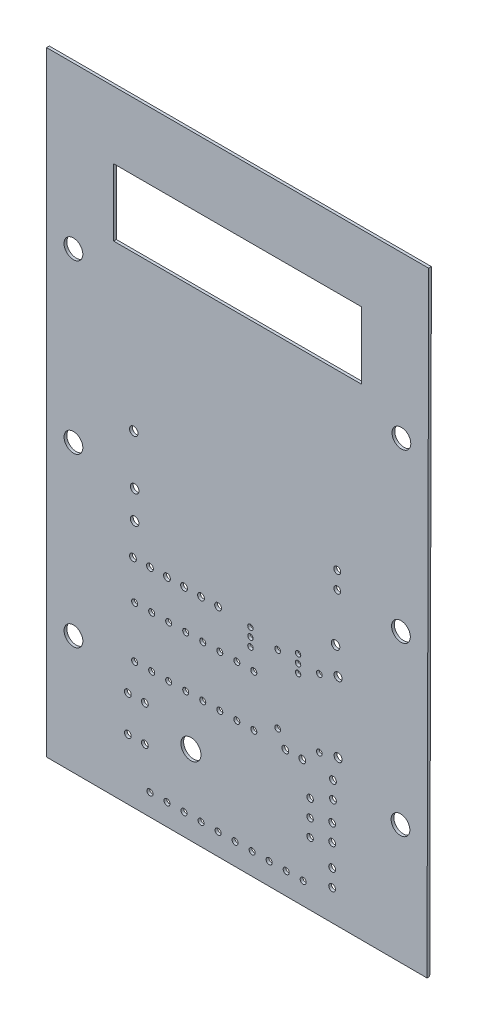
from build123d import *

# Parameters (mm, degrees)
SKETCH1_R           = 0.508
SKETCH1_R_2         = 0.5999988
SKETCH1_R_3         = 0.635
SKETCH1_R_4         = 0.3999992
SKETCH1_R_5         = 0.42500042
SKETCH1_R_6         = 0.4499991
SKETCH1_R_7         = 0.4826
SKETCH1_R_8         = 1.499997
SKETCH1_R_9         = 1.4
SKETCH1_W           = 36.995943026
SKETCH1_H           = 10
BOSS_EXTRUDE1_DEPTH = 0.41148


with BuildPart() as part:
    # Sketch1 → Boss-Extrude1 (new body)
    with BuildSketch(Plane.XY):
        Polygon((70.438392982, 67.709058894), (127.180315397, 67.544049582), (127.428203039, 159.380807101), (70.428082966, 159.380807101), align=None)
        with Locations(Location((113.792, 110.998, 0), (0, 0, 180))):
            Circle(SKETCH1_R, mode=Mode.SUBTRACT)
        with Locations(Location((113.792, 113.538, 0), (0, 0, 180))):
            Circle(SKETCH1_R, mode=Mode.SUBTRACT)
        with Locations(Location((113.919, 99.8449997, 0), (0, 0, 180))):
            Circle(SKETCH1_R_2, mode=Mode.SUBTRACT)
        with Locations(Location((113.538, 103.759, 0), (0, 0, 180))):
            Circle(SKETCH1_R_3, mode=Mode.SUBTRACT)
        with Locations(Location((107.95, 99.822, 0), (0, 0, 180))):
            Circle(SKETCH1_R_4, mode=Mode.SUBTRACT)
        with Locations(Location((111.125, 98.806, 0), (0, 0, 180))):
            Circle(SKETCH1_R_5, mode=Mode.SUBTRACT)
        with Locations(Location((113.919, 89.3850003, 0), (0, 0, 180))):
            Circle(SKETCH1_R_2, mode=Mode.SUBTRACT)
        with Locations(Location((107.95, 98.552, 0), (0, 0, 180))):
            Circle(SKETCH1_R_4, mode=Mode.SUBTRACT)
        with Locations(Location((111.125, 88.646, 0), (0, 0, 180))):
            Circle(SKETCH1_R_5, mode=Mode.SUBTRACT)
        with Locations(Location((104.902, 98.806, 0), (0, 0, 180))):
            Circle(SKETCH1_R_5, mode=Mode.SUBTRACT)
        with Locations(Location((107.95, 97.282, 0), (0, 0, 180))):
            Circle(SKETCH1_R_4, mode=Mode.SUBTRACT)
        with Locations(Location((100.838, 99.695, 0), (0, 0, 180))):
            Circle(SKETCH1_R_4, mode=Mode.SUBTRACT)
        with Locations(Location((100.838, 98.425, 0), (0, 0, 180))):
            Circle(SKETCH1_R_4, mode=Mode.SUBTRACT)
        with Locations(Location((101.346, 94.234, 0), (0, 0, 180))):
            Circle(SKETCH1_R_6, mode=Mode.SUBTRACT)
        with Locations(Location((104.902, 88.646, 0), (0, 0, 180))):
            Circle(SKETCH1_R_5, mode=Mode.SUBTRACT)
        with Locations(Location((100.838, 97.155, 0), (0, 0, 180))):
            Circle(SKETCH1_R_4, mode=Mode.SUBTRACT)
        with Locations(Location((101.346, 86.614, 0), (0, 0, 180))):
            Circle(SKETCH1_R_6, mode=Mode.SUBTRACT)
        with Locations(Location((113.157, 86.106, 0), (0, 0, 180))):
            Circle(SKETCH1_R, mode=Mode.SUBTRACT)
        with Locations(Location((113.157, 83.566, 0), (0, 0, 180))):
            Circle(SKETCH1_R, mode=Mode.SUBTRACT)
        with Locations(Location((109.74201826, 82.0511948, 0), (0, 0, 180))):
            Circle(SKETCH1_R_7, mode=Mode.SUBTRACT)
        with Locations(Location((113.03, 80.518, 0), (0, 0, 180))):
            Circle(SKETCH1_R, mode=Mode.SUBTRACT)
        with Locations(Location((113.03, 74.676, 0), (0, 0, 180))):
            Circle(SKETCH1_R, mode=Mode.SUBTRACT)
        with Locations(Location((113.03, 72.136, 0), (0, 0, 180))):
            Circle(SKETCH1_R, mode=Mode.SUBTRACT)
        with Locations(Location((109.74201826, 79.5111948, 0), (0, 0, 180))):
            Circle(SKETCH1_R_7, mode=Mode.SUBTRACT)
        with Locations(Location((113.03, 77.978, 0), (0, 0, 180))):
            Circle(SKETCH1_R, mode=Mode.SUBTRACT)
        with Locations(Location((108.585, 86.487, 0), (0, 0, 180))):
            Circle(SKETCH1_R, mode=Mode.SUBTRACT)
        with Locations(Location((109.74201826, 76.9711948, 0), (0, 0, 180))):
            Circle(SKETCH1_R_7, mode=Mode.SUBTRACT)
        with Locations(Location((98.806, 86.614, 0), (0, 0, 180))):
            Circle(SKETCH1_R_6, mode=Mode.SUBTRACT)
        with Locations(Location((106.045, 86.487, 0), (0, 0, 180))):
            Circle(SKETCH1_R, mode=Mode.SUBTRACT)
        with Locations(Location((106.172, 70.866, 0), (0, 0, 180))):
            Circle(SKETCH1_R_6, mode=Mode.SUBTRACT)
        with Locations(Location((108.712, 70.866, 0), (0, 0, 180))):
            Circle(SKETCH1_R_6, mode=Mode.SUBTRACT)
        with Locations(Location((101.092, 70.866, 0), (0, 0, 180))):
            Circle(SKETCH1_R_6, mode=Mode.SUBTRACT)
        with Locations(Location((103.632, 70.866, 0), (0, 0, 180))):
            Circle(SKETCH1_R_6, mode=Mode.SUBTRACT)
        with Locations(Location((96.266, 94.234, 0), (0, 0, 180))):
            Circle(SKETCH1_R_6, mode=Mode.SUBTRACT)
        with Locations(Location((96.012, 99.949, 0), (0, 0, 180))):
            Circle(SKETCH1_R, mode=Mode.SUBTRACT)
        with Locations(Location((93.726, 94.234, 0), (0, 0, 180))):
            Circle(SKETCH1_R_6, mode=Mode.SUBTRACT)
        with Locations(Location((90.932, 99.949, 0), (0, 0, 180))):
            Circle(SKETCH1_R, mode=Mode.SUBTRACT)
        with Locations(Location((93.472, 99.949, 0), (0, 0, 180))):
            Circle(SKETCH1_R, mode=Mode.SUBTRACT)
        with Locations(Location((98.806, 94.234, 0), (0, 0, 180))):
            Circle(SKETCH1_R_6, mode=Mode.SUBTRACT)
        with Locations(Location((93.726, 86.614, 0), (0, 0, 180))):
            Circle(SKETCH1_R_6, mode=Mode.SUBTRACT)
        with Locations(Location((88.646, 94.234, 0), (0, 0, 180))):
            Circle(SKETCH1_R_6, mode=Mode.SUBTRACT)
        with Locations(Location((91.186, 94.234, 0), (0, 0, 180))):
            Circle(SKETCH1_R_6, mode=Mode.SUBTRACT)
        with Locations(Location((83.566, 104.775, 0), (0, 0, 180))):
            Circle(SKETCH1_R_3, mode=Mode.SUBTRACT)
        with Locations(Location((85.852, 99.949, 0), (0, 0, 180))):
            Circle(SKETCH1_R, mode=Mode.SUBTRACT)
        with Locations(Location((83.439, 116.332, 0), (0, 0, 180))):
            Circle(SKETCH1_R_3, mode=Mode.SUBTRACT)
        with Locations(Location((83.566, 108.966, 0), (0, 0, 180))):
            Circle(SKETCH1_R_3, mode=Mode.SUBTRACT)
        with Locations(Location((88.392, 99.949, 0), (0, 0, 180))):
            Circle(SKETCH1_R, mode=Mode.SUBTRACT)
        with Locations(Location((86.106, 94.234, 0), (0, 0, 180))):
            Circle(SKETCH1_R_6, mode=Mode.SUBTRACT)
        with Locations(Location((83.312, 99.949, 0), (0, 0, 180))):
            Circle(SKETCH1_R, mode=Mode.SUBTRACT)
        with Locations(Location((83.566, 94.234, 0), (0, 0, 180))):
            Circle(SKETCH1_R_6, mode=Mode.SUBTRACT)
        with Locations(Location((91.186, 86.614, 0), (0, 0, 180))):
            Circle(SKETCH1_R_6, mode=Mode.SUBTRACT)
        with Locations(Location((96.266, 86.614, 0), (0, 0, 180))):
            Circle(SKETCH1_R_6, mode=Mode.SUBTRACT)
        with Locations(Location((88.646, 86.614, 0), (0, 0, 180))):
            Circle(SKETCH1_R_6, mode=Mode.SUBTRACT)
        with Locations(Location((91.9620208, 79.5111948, 0), (0, 0, 180))):
            Circle(SKETCH1_R_8, mode=Mode.SUBTRACT)
        with Locations(Location((96.012, 70.866, 0), (0, 0, 180))):
            Circle(SKETCH1_R_6, mode=Mode.SUBTRACT)
        with Locations(Location((98.552, 70.866, 0), (0, 0, 180))):
            Circle(SKETCH1_R_6, mode=Mode.SUBTRACT)
        with Locations(Location((90.932, 70.866, 0), (0, 0, 180))):
            Circle(SKETCH1_R_6, mode=Mode.SUBTRACT)
        with Locations(Location((93.472, 70.866, 0), (0, 0, 180))):
            Circle(SKETCH1_R_6, mode=Mode.SUBTRACT)
        with Locations(Location((86.106, 86.614, 0), (0, 0, 180))):
            Circle(SKETCH1_R_6, mode=Mode.SUBTRACT)
        with Locations(Location((85.09, 82.042, 0), (0, 0, 180))):
            Circle(SKETCH1_R, mode=Mode.SUBTRACT)
        with Locations(Location((83.566, 86.614, 0), (0, 0, 180))):
            Circle(SKETCH1_R_6, mode=Mode.SUBTRACT)
        with Locations(Location((82.55, 82.042, 0), (0, 0, 180))):
            Circle(SKETCH1_R, mode=Mode.SUBTRACT)
        with Locations(Location((85.852, 70.866, 0), (0, 0, 180))):
            Circle(SKETCH1_R_6, mode=Mode.SUBTRACT)
        with Locations(Location((88.392, 70.866, 0), (0, 0, 180))):
            Circle(SKETCH1_R_6, mode=Mode.SUBTRACT)
        with Locations(Location((82.55, 76.708, 0), (0, 0, 180))):
            Circle(SKETCH1_R, mode=Mode.SUBTRACT)
        with Locations(Location((85.09, 76.708, 0), (0, 0, 180))):
            Circle(SKETCH1_R, mode=Mode.SUBTRACT)
        with Locations((123.36340718, 135.380807101)):
            Circle(SKETCH1_R_9, mode=Mode.SUBTRACT)
        with Locations((74.430782191, 135.380807101)):
            Circle(SKETCH1_R_9, mode=Mode.SUBTRACT)
        with Locations((74.433593858, 110.380807101)):
            Circle(SKETCH1_R_9, mode=Mode.SUBTRACT)
        with Locations((123.295926672, 110.380807101)):
            Circle(SKETCH1_R_9, mode=Mode.SUBTRACT)
        with Locations((74.436405524, 85.380807101)):
            Circle(SKETCH1_R_9, mode=Mode.SUBTRACT)
        with Locations((123.228446164, 85.380807101)):
            Circle(SKETCH1_R_9, mode=Mode.SUBTRACT)
        with Locations((98.932971513, 144.380807101)):
            Rectangle(SKETCH1_W, SKETCH1_H, mode=Mode.SUBTRACT)
    extrude(amount=-BOSS_EXTRUDE1_DEPTH)


solid = part.part
